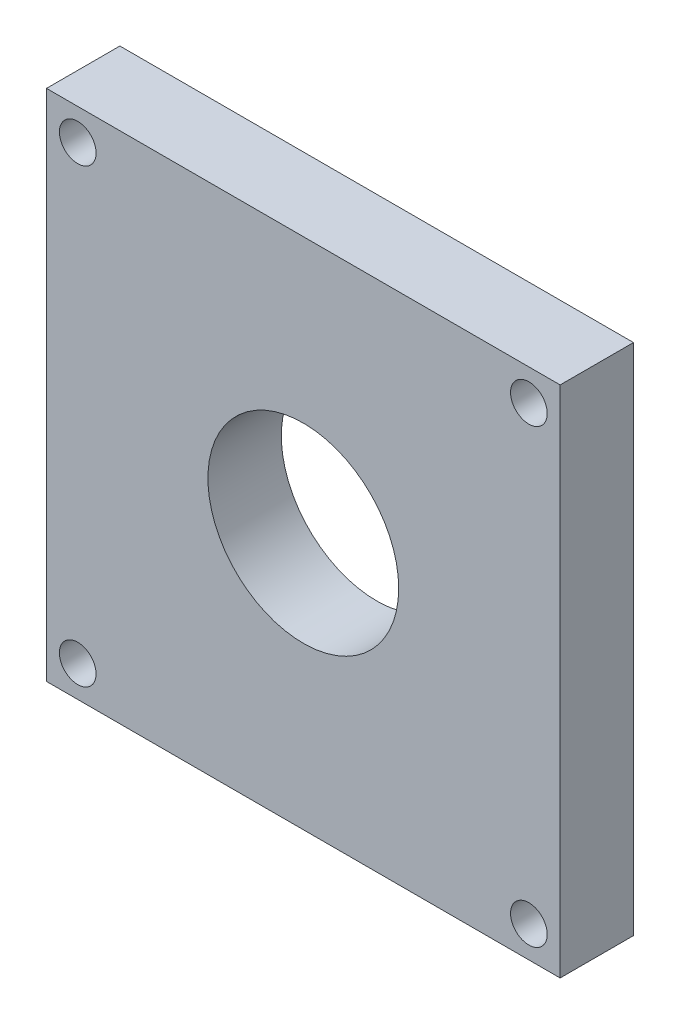
from build123d import *

# Parameters (mm, degrees)
CROQUIS1_W              = 35
CROQUIS1_H              = 35
CROQUIS1_R              = 1.25
CROQUIS1_R_2            = 6.5
SALIENTE_EXTRUIR1_DEPTH = 5


with BuildPart() as part:
    # Croquis1 → Saliente-Extruir1 (new body)
    with BuildSketch(Plane.XY):
        Rectangle(CROQUIS1_W, CROQUIS1_H)
        with Locations((-15.37, 15.37)):
            Circle(CROQUIS1_R, mode=Mode.SUBTRACT)
        with Locations((15.37, 15.37)):
            Circle(CROQUIS1_R, mode=Mode.SUBTRACT)
        with Locations((15.37, -15.37)):
            Circle(CROQUIS1_R, mode=Mode.SUBTRACT)
        with Locations((-15.37, -15.37)):
            Circle(CROQUIS1_R, mode=Mode.SUBTRACT)
        Circle(CROQUIS1_R_2, mode=Mode.SUBTRACT)
    extrude(amount=SALIENTE_EXTRUIR1_DEPTH)


solid = part.part
